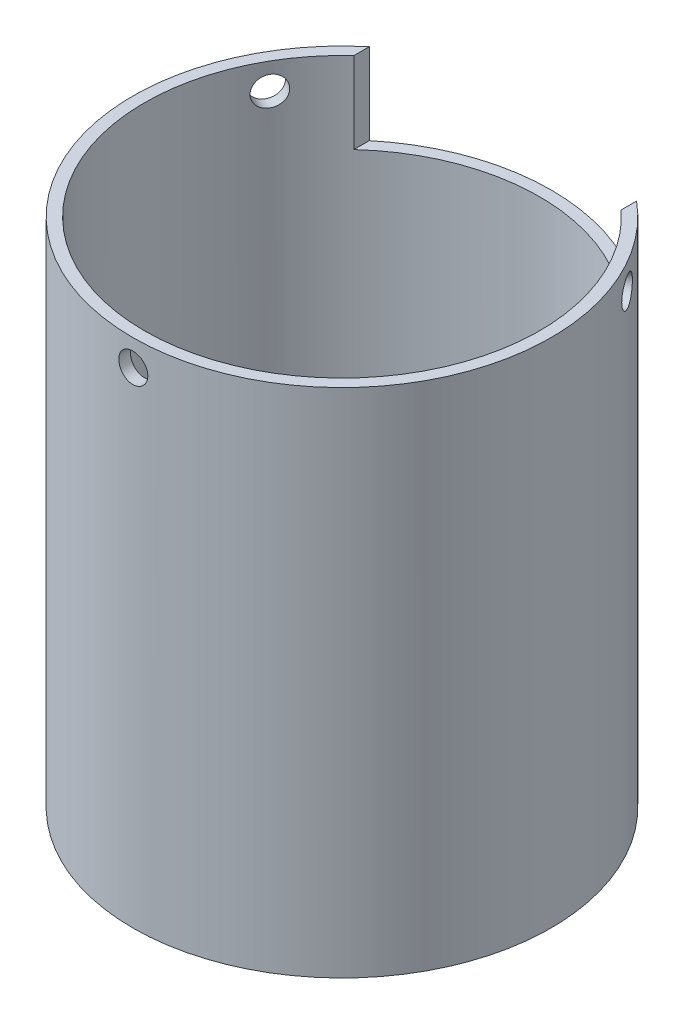
from build123d import *

# Parameters (mm, degrees)
SKETCH1_R           = 18
BOSS_EXTRUDE1_DEPTH = 44
SKETCH3_R           = 17
CUT_EXTRUDE2_DEPTH  = 51.833060109
SKETCH11_W          = 23
SKETCH11_H          = 15.641557415
CUT_EXTRUDE4_DEPTH  = 7
SKETCH13_R          = 1.25
CUT_EXTRUDE5_DEPTH  = 20
CIRPATTERN1_COUNT   = 3


with BuildPart() as part:
    # Sketch1 → Boss-Extrude1 (new body)
    with BuildSketch(Plane(origin=(0, 0, 0), x_dir=(1, 0, 0), z_dir=(0, 1, 0))):
        with Locations(Location((0, 0, 0), (0, 0, 270))):
            Circle(SKETCH1_R)
    extrude(amount=BOSS_EXTRUDE1_DEPTH)

    # Sketch3 → Cut-Extrude2 (cut, through all)
    with BuildSketch(Plane(origin=(0, 44, 0), x_dir=(1, 0, 0), z_dir=(0, 1, 0))):
        with Locations(Location((0, 0, 0), (0, 0, 270))):
            Circle(SKETCH3_R)
    extrude(amount=-CUT_EXTRUDE2_DEPTH, mode=Mode.SUBTRACT)

    # Sketch11 → Cut-Extrude4 (cut)
    with BuildSketch(Plane(origin=(0, 44, 0), x_dir=(1, 0, 0), z_dir=(0, 1, 0))):
        with Locations((0, 14.057671998)):
            Rectangle(SKETCH11_W, SKETCH11_H)
    extrude(amount=-CUT_EXTRUDE4_DEPTH, mode=Mode.SUBTRACT)

    # Sketch13 → Cut-Extrude5 (cut)
    with BuildSketch(Plane.XY):
        with Locations(Location((0, 41.75, 0), (0, 0, 180))):
            Circle(SKETCH13_R)
    cut_extrude5 = extrude(amount=CUT_EXTRUDE5_DEPTH, mode=Mode.SUBTRACT)

    # CirPattern1: Cut-Extrude5 ×3 about axis
    cirpattern1_axis = Axis((0, 0, 0), (0, 1, 0))
    for i in range(1, CIRPATTERN1_COUNT):
        add(cut_extrude5.rotate(cirpattern1_axis, i * 360 / CIRPATTERN1_COUNT), mode=Mode.SUBTRACT)


solid = part.part
